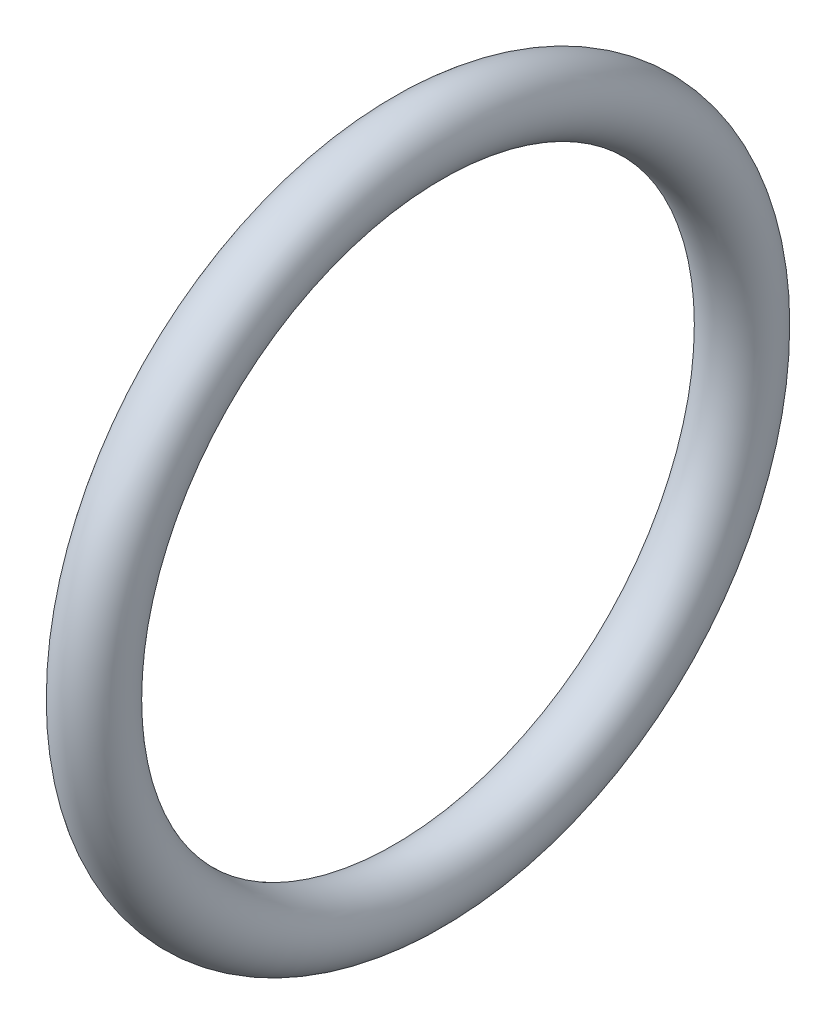
from build123d import *

# Parameters (mm, degrees)
ESQUISSE1_R = 2.5


with BuildPart() as part:
    # Esquisse1 → Révolution1 (revolve)
    with BuildSketch(Plane.XY):
        with Locations((0, 24)):
            Circle(ESQUISSE1_R)
    revolve(axis=Axis((0, 0, 0), (-1, 0, 0)))


solid = part.part
